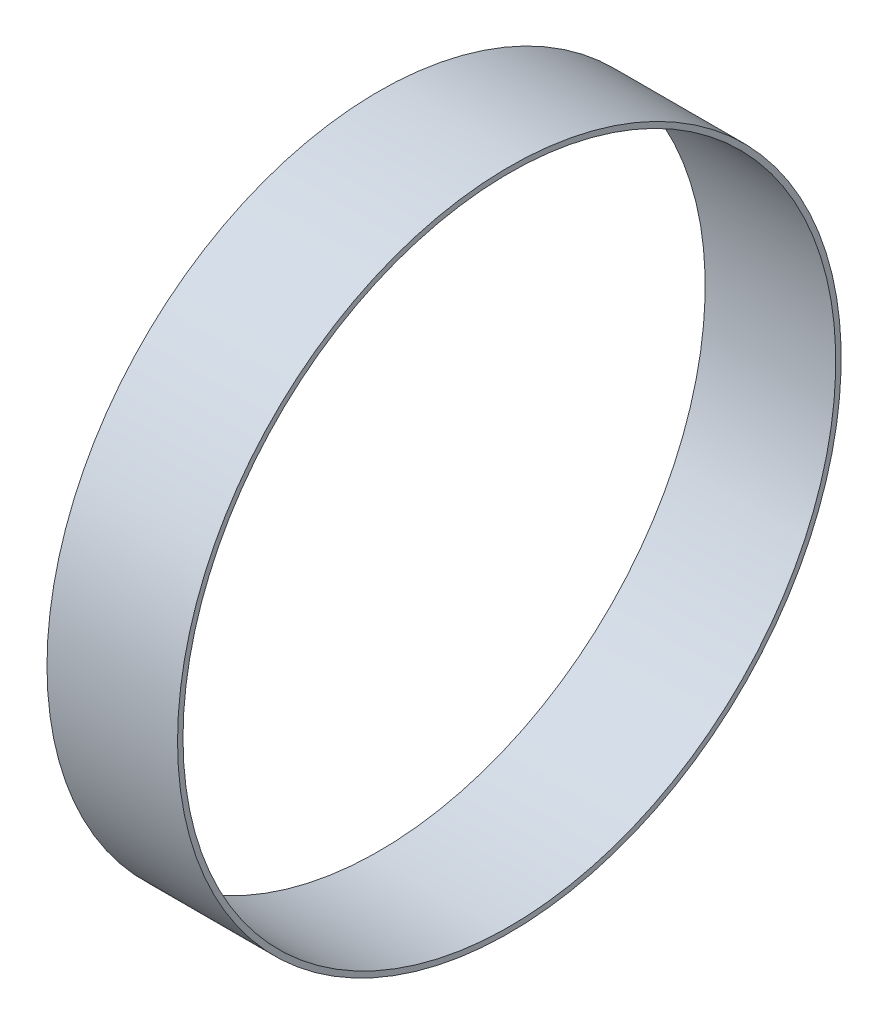
from build123d import *

# Parameters (mm, degrees)
SKETCH1_R           = 193.675
SKETCH1_R_2         = 190.5
BOSS_EXTRUDE1_DEPTH = 76.2


with BuildPart() as part:
    # Sketch1 → Boss-Extrude1 (new body)
    with BuildSketch(Plane(origin=(0, 0, 0), x_dir=(0, 0, -1), z_dir=(1, 0, 0))):
        with Locations(Location((0, 0, 0), (0, 0, 180))):
            Circle(SKETCH1_R)
        with Locations(Location((0, 0, 0), (0, 0, 180))):
            Circle(SKETCH1_R_2, mode=Mode.SUBTRACT)
    extrude(amount=BOSS_EXTRUDE1_DEPTH)


solid = part.part
